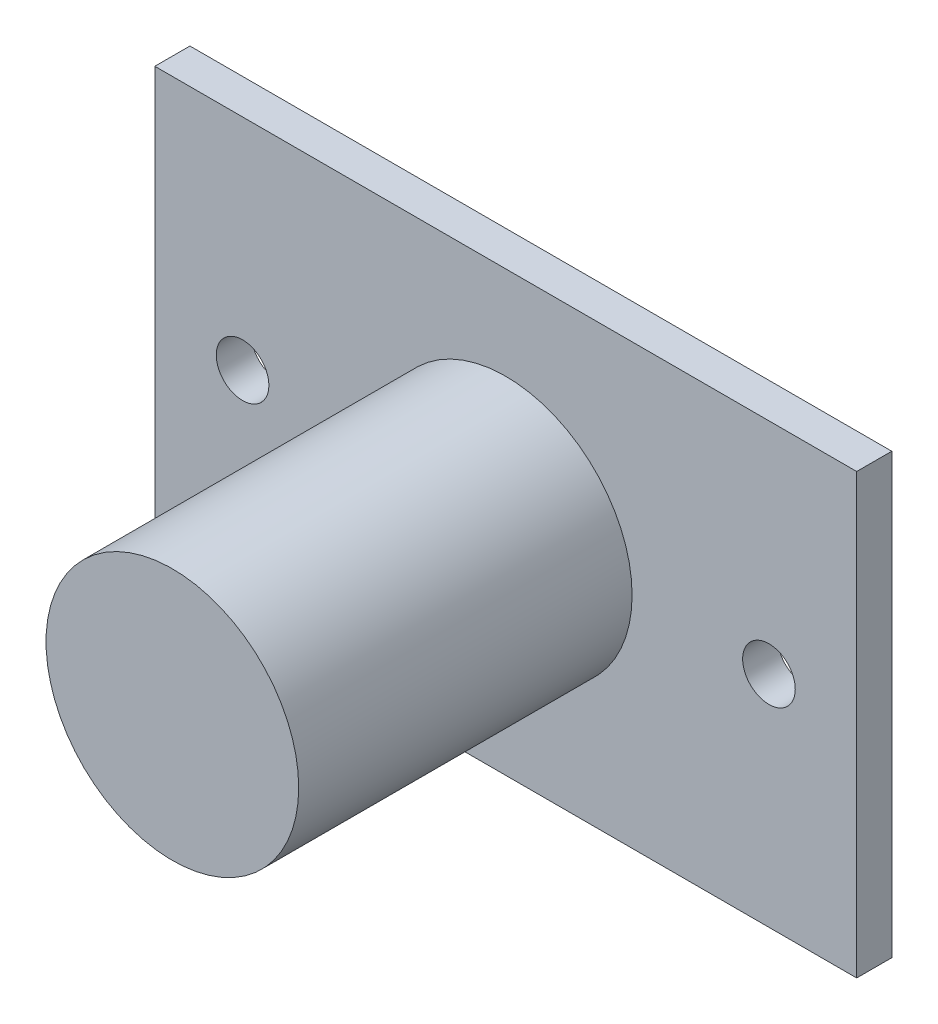
from build123d import *

# Parameters (mm, degrees)
SKETCH1_W           = 40
SKETCH1_H           = 25
SKETCH1_R           = 1.5
BOSS_EXTRUDE1_DEPTH = 2
SKETCH2_R           = 7.2
BOSS_EXTRUDE2_DEPTH = 19


with BuildPart() as part:
    # Sketch1 → Boss-Extrude1 (new body)
    with BuildSketch(Plane.XY):
        Rectangle(SKETCH1_W, SKETCH1_H)
        with Locations((15, 0)):
            Circle(SKETCH1_R, mode=Mode.SUBTRACT)
        with Locations((-15, 0)):
            Circle(SKETCH1_R, mode=Mode.SUBTRACT)
    extrude(amount=BOSS_EXTRUDE1_DEPTH)

    # Sketch2 → Boss-Extrude2 (add)
    with BuildSketch(Plane.XY.offset(2)):
        Circle(SKETCH2_R)
    extrude(amount=BOSS_EXTRUDE2_DEPTH)


solid = part.part
